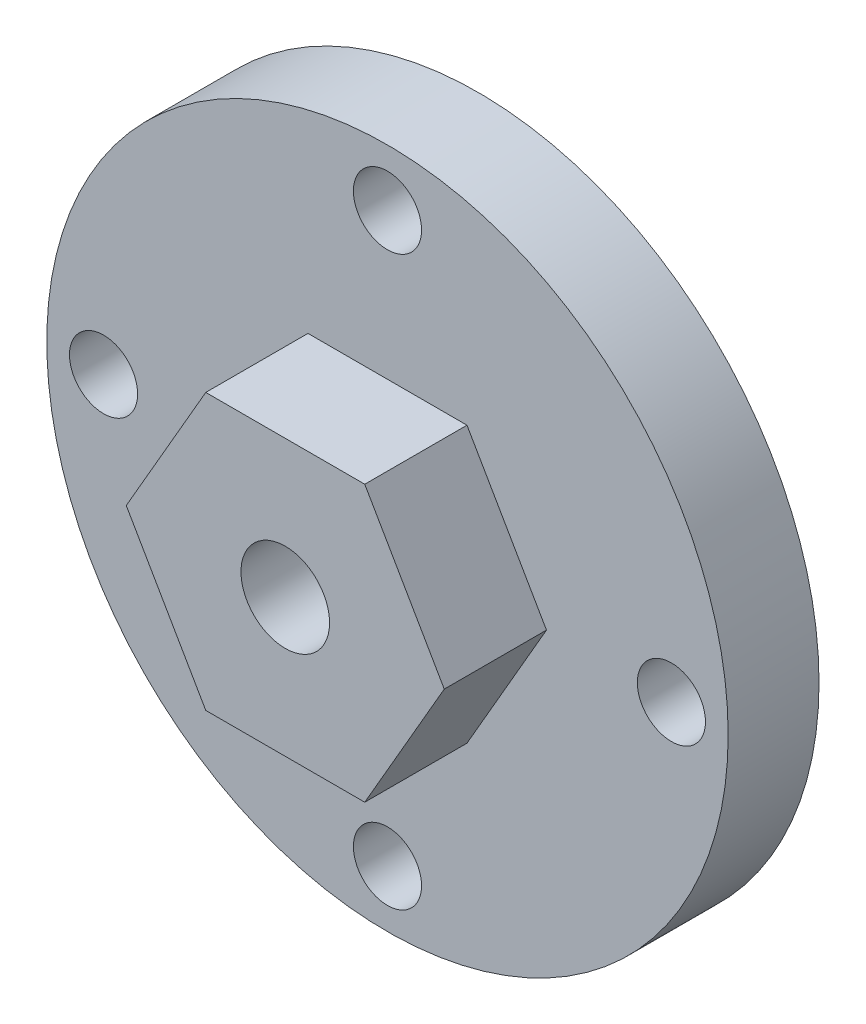
from build123d import *

# Parameters (mm, degrees)
SKETCH_1_R          = 15
EXTRUDE_1_DEPTH     = 4
EXTRUDE_2_DEPTH     = 4.5
SKETCH_3_R          = 1.95
CUT_EXTRUDE_1_DEPTH = 23.852789764
SKETCH_6_R          = 1.5
CUT_EXTRUDE_2_DEPTH = 23.852789764


with BuildPart() as part:
    # 草图1 → 凸台-拉伸1 (new body)
    with BuildSketch(Plane.XY):
        Circle(SKETCH_1_R)
    extrude(amount=EXTRUDE_1_DEPTH)

    # 草图2 → 凸台-拉伸2 (add)
    with BuildSketch(Plane.XY.offset(4)):
        Polygon((3.5, 6.062177826), (-3.5, 6.062177826), (-7, 0), (-3.5, -6.062177826), (3.5, -6.062177826), (7, 0), align=None)
    extrude(amount=EXTRUDE_2_DEPTH)

    # 草图3 → 切除-拉伸1 (cut, through all)
    with BuildSketch(Plane.XY.offset(8.5)):
        Circle(SKETCH_3_R)
    extrude(amount=-CUT_EXTRUDE_1_DEPTH, mode=Mode.SUBTRACT)

    # 草图6 → 切除-拉伸2 (cut, through all)
    with BuildSketch(Plane(origin=(0, 0, 0), x_dir=(-1, 0, 0), z_dir=(0, 0, -1))):
        with Locations((0, 12.5)):
            Circle(SKETCH_6_R)
        with Locations((12.5, 0)):
            Circle(SKETCH_6_R)
        with Locations((0, -12.5)):
            Circle(SKETCH_6_R)
        with Locations((-12.5, 0)):
            Circle(SKETCH_6_R)
    extrude(amount=-CUT_EXTRUDE_2_DEPTH, mode=Mode.SUBTRACT)


solid = part.part
